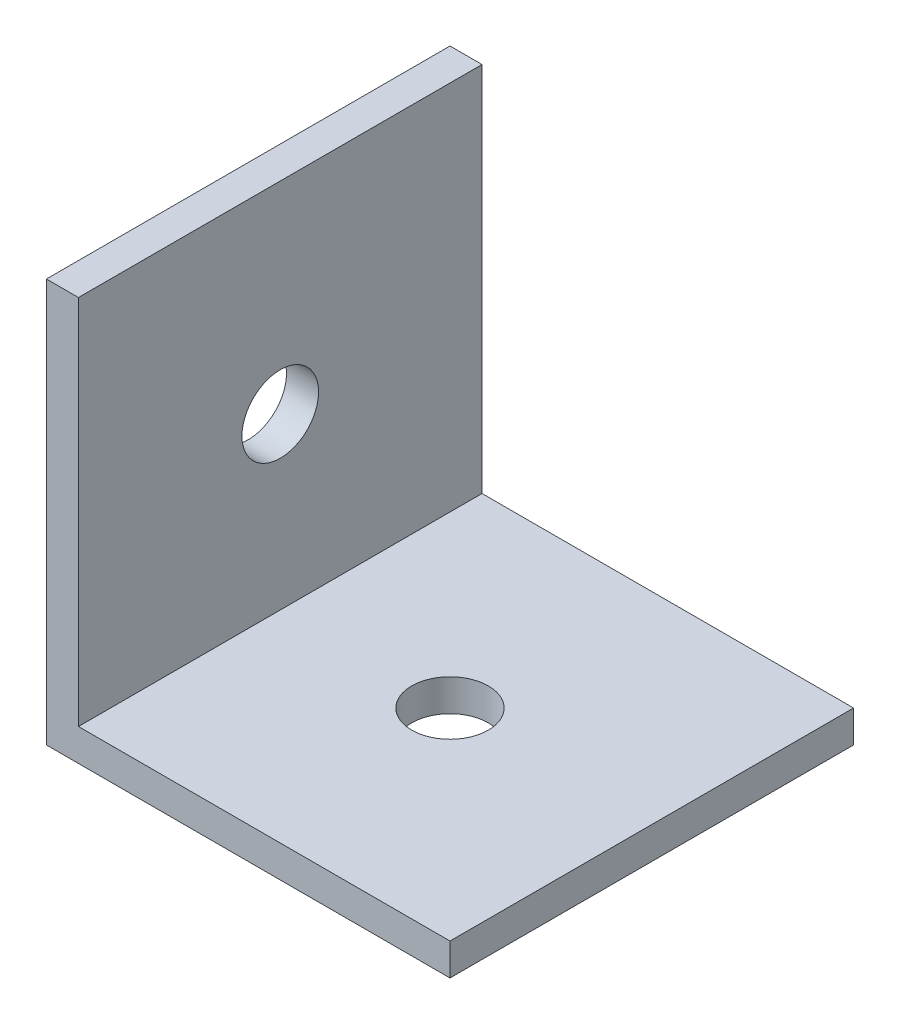
from build123d import *

# Parameters (mm, degrees)
BOSS_EXTRUDE1_DEPTH       = 10
F_6_CLEARANCE_HOLE1_D     = 3.7973
F_6_CLEARANCE_HOLE1_DEPTH = 20.001
F_6_CLEARANCE_HOLE1_TIP   = 1.140824014
F_6_CLEARANCE_HOLE2_D     = 3.7973


with BuildPart() as part:
    # Sketch1 → Boss-Extrude1 (new, symmetric)
    with BuildSketch(Plane.XY):
        Polygon((0, 20), (0, 0), (20, 0), (20, 1.5875), (1.5875, 1.5875), (1.5875, 20), align=None)
    extrude(amount=BOSS_EXTRUDE1_DEPTH, both=True)

    # #6 Clearance Hole1
    with Locations(Plane(origin=(0, 0, 0), x_dir=(-1, 0, 0), z_dir=(0, -1, 0))):
        with Locations((-10, 0)):
            Hole(F_6_CLEARANCE_HOLE1_D / 2, depth=F_6_CLEARANCE_HOLE1_DEPTH)
            with Locations((0, 0, -(F_6_CLEARANCE_HOLE1_DEPTH + F_6_CLEARANCE_HOLE1_TIP / 2))):  # 118° drill point
                Cone(0, F_6_CLEARANCE_HOLE1_D / 2, F_6_CLEARANCE_HOLE1_TIP, mode=Mode.SUBTRACT)

    # #6 Clearance Hole2 (through all)
    with Locations(Plane.ZY):
        with Locations((0, 10)):
            Hole(F_6_CLEARANCE_HOLE2_D / 2)


solid = part.part
